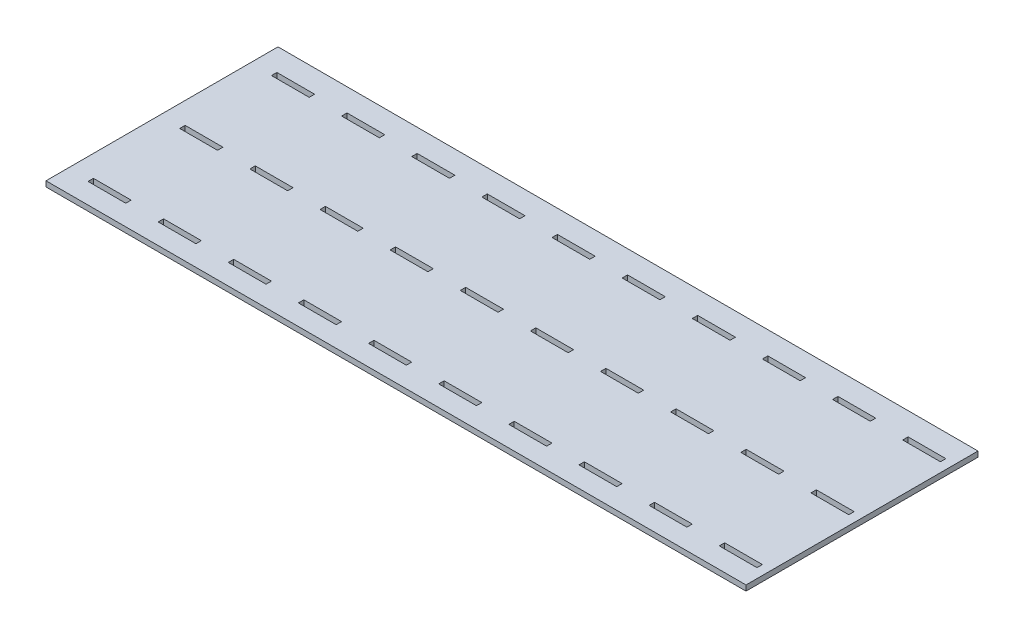
from build123d import *

# Parameters (mm, degrees)
SKETCH1_W               = 939.8
SKETCH1_H               = 273.05
BOSS_EXTRUDE1_DEPTH     = 6.35
CUT_EXTRUDE1_DEPTH      = 979.683127984
CUT_EXTRUDE1_DEPTH_BACK = 979.683127984
SKETCH2_W               = 44.45
SKETCH2_H               = 6.35
SKETCH2_W_2             = 88.9
SKETCH3_W               = 115.877039993
SKETCH3_H               = 273.05
CUT_EXTRUDE2_DEPTH      = 6.35


with BuildPart() as part:
    # Sketch1 → Boss-Extrude1 (new body)
    with BuildSketch(Plane(origin=(0, 0, 0), x_dir=(1, 0, 0), z_dir=(0, 1, 0))):
        with Locations((469.9, -136.525)):
            Rectangle(SKETCH1_W, SKETCH1_H)
    extrude(amount=BOSS_EXTRUDE1_DEPTH)

    # Sketch2 → Cut-Extrude1 (cut, two sides: drawn at the far end of the back side and taken through both)
    with BuildSketch(Plane(origin=(0, 6.35, 0), x_dir=(1, 0, 0), z_dir=(0, 1, 0)).offset(-CUT_EXTRUDE1_DEPTH_BACK)):
        with Locations((47.625, -29.913697199)):
            Rectangle(SKETCH2_W, SKETCH2_H)
        with Locations((130.175, -29.913697199)):
            Rectangle(SKETCH2_W, SKETCH2_H)
        with Locations((212.725, -29.913697199)):
            Rectangle(SKETCH2_W, SKETCH2_H)
        with Locations((295.275, -29.913697199)):
            Rectangle(SKETCH2_W, SKETCH2_H)
        with Locations((377.825, -29.913697199)):
            Rectangle(SKETCH2_W, SKETCH2_H)
        with Locations((460.375, -29.913697199)):
            Rectangle(SKETCH2_W, SKETCH2_H)
        with Locations((542.925, -29.913697199)):
            Rectangle(SKETCH2_W, SKETCH2_H)
        with Locations((625.475, -29.913697199)):
            Rectangle(SKETCH2_W, SKETCH2_H)
        with Locations((708.025, -29.913697199)):
            Rectangle(SKETCH2_W, SKETCH2_H)
        with Locations((790.575, -29.913697199)):
            Rectangle(SKETCH2_W, SKETCH2_H)
        with Locations((130.175, -137.863697199)):
            Rectangle(SKETCH2_W, SKETCH2_H)
        with Locations((212.725, -137.863697199)):
            Rectangle(SKETCH2_W, SKETCH2_H)
        with Locations((295.275, -137.863697199)):
            Rectangle(SKETCH2_W, SKETCH2_H)
        with Locations((377.825, -137.863697199)):
            Rectangle(SKETCH2_W, SKETCH2_H)
        with Locations((460.375, -137.863697199)):
            Rectangle(SKETCH2_W, SKETCH2_H)
        with Locations((542.925, -137.863697199)):
            Rectangle(SKETCH2_W, SKETCH2_H)
        with Locations((625.475, -137.863697199)):
            Rectangle(SKETCH2_W, SKETCH2_H)
        with Locations((708.025, -137.863697199)):
            Rectangle(SKETCH2_W, SKETCH2_H)
        with Locations((790.575, -137.863697199)):
            Rectangle(SKETCH2_W, SKETCH2_H)
        with Locations((130.175, -245.813697199)):
            Rectangle(SKETCH2_W, SKETCH2_H)
        with Locations((212.725, -245.813697199)):
            Rectangle(SKETCH2_W, SKETCH2_H)
        with Locations((295.275, -245.813697199)):
            Rectangle(SKETCH2_W, SKETCH2_H)
        with Locations((377.825, -245.813697199)):
            Rectangle(SKETCH2_W, SKETCH2_H)
        with Locations((460.375, -245.813697199)):
            Rectangle(SKETCH2_W, SKETCH2_H)
        with Locations((542.925, -245.813697199)):
            Rectangle(SKETCH2_W, SKETCH2_H)
        with Locations((625.475, -245.813697199)):
            Rectangle(SKETCH2_W, SKETCH2_H)
        with Locations((708.025, -245.813697199)):
            Rectangle(SKETCH2_W, SKETCH2_H)
        with Locations((790.575, -245.813697199)):
            Rectangle(SKETCH2_W, SKETCH2_H)
        with Locations((47.625, -137.863697199)):
            Rectangle(SKETCH2_W, SKETCH2_H)
        with Locations((47.625, -245.813697199)):
            Rectangle(SKETCH2_W, SKETCH2_H)
        with Locations((895.35, -137.863697199)):
            Rectangle(SKETCH2_W_2, SKETCH2_H)
        with Locations((895.35, -29.913697199)):
            Rectangle(SKETCH2_W_2, SKETCH2_H)
        with Locations((895.35, -245.813697199)):
            Rectangle(SKETCH2_W_2, SKETCH2_H)
    extrude(amount=CUT_EXTRUDE1_DEPTH + CUT_EXTRUDE1_DEPTH_BACK, mode=Mode.SUBTRACT)

    # Sketch3 → Cut-Extrude2 (cut)
    with BuildSketch(Plane.XZ):
        with Locations((881.861480003, 136.525)):
            Rectangle(SKETCH3_W, SKETCH3_H)
    extrude(amount=-CUT_EXTRUDE2_DEPTH, mode=Mode.SUBTRACT)


solid = part.part
